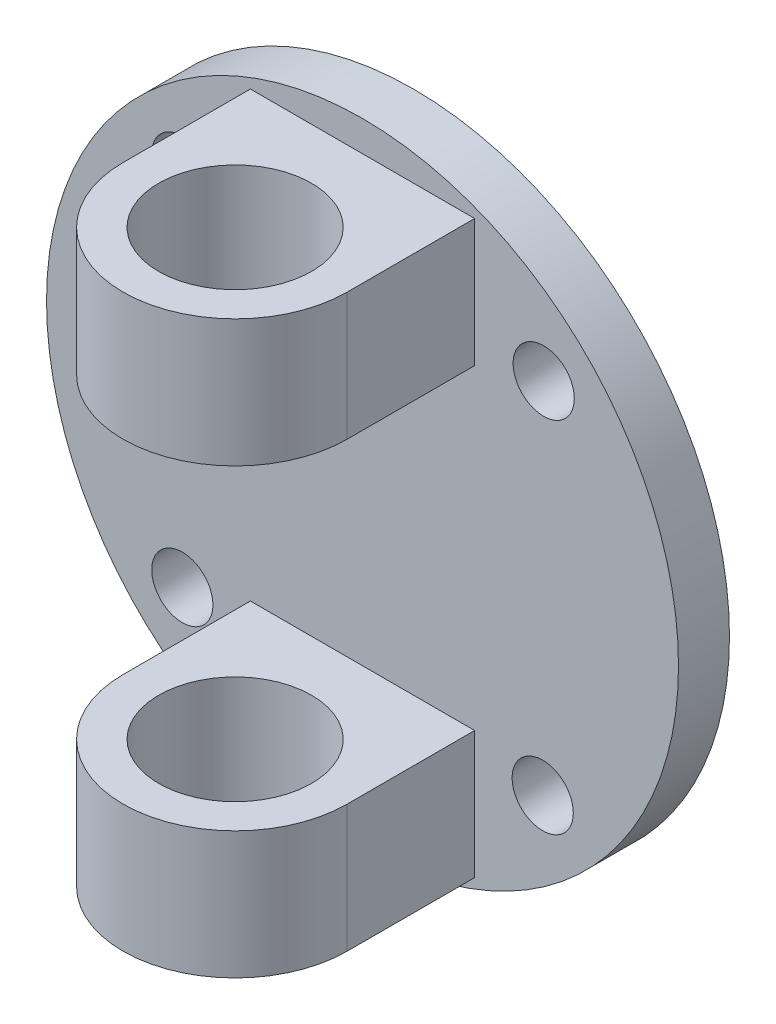
from build123d import *

# Parameters (mm, degrees)
SKETCH1_R           = 62
BOSS_EXTRUDE1_DEPTH = 10
SKETCH2_R           = 6
CUT_EXTRUDE1_DEPTH  = 10
SKETCH4_W           = 44
SKETCH4_H           = 25
BOSS_EXTRUDE2_DEPTH = 25
BOSS_EXTRUDE5_DEPTH = 25
BOSS_EXTRUDE6_START = -25
BOSS_EXTRUDE6_DEPTH = 25
SKETCH9_R           = 15
CUT_EXTRUDE2_DEPTH  = 25
CUT_EXTRUDE3_START  = -25
SKETCH10_R          = 15
CUT_EXTRUDE3_DEPTH  = 25


with BuildPart() as part:
    # Sketch1 → Boss-Extrude1 (new body)
    with BuildSketch(Plane.XY):
        Circle(SKETCH1_R)
    extrude(amount=BOSS_EXTRUDE1_DEPTH)

    # Sketch2 → Cut-Extrude1 (cut)
    with BuildSketch(Plane.XY.offset(10)):
        with Locations((35.355339059, -35.355339059)):
            Circle(SKETCH2_R)
        with Locations((-35.355339059, -35.355339059)):
            Circle(SKETCH2_R)
        with Locations((-35.355339059, 35.355339059)):
            Circle(SKETCH2_R)
        with Locations((35.548908594, 35.160703886)):
            Circle(SKETCH2_R)
    extrude(amount=-CUT_EXTRUDE1_DEPTH, mode=Mode.SUBTRACT)

    # Sketch4 → Boss-Extrude2 (add)
    with BuildSketch(Plane.XY.offset(10)):
        with Locations((0, 43.5)):
            Rectangle(SKETCH4_W, SKETCH4_H)
        with Locations((0, -43.5)):
            Rectangle(SKETCH4_W, SKETCH4_H)
    extrude(amount=BOSS_EXTRUDE2_DEPTH)

    # Sketch5 → Boss-Extrude5 (add)
    with BuildSketch(Plane(origin=(0, 56, 0), x_dir=(1, 0, 0), z_dir=(0, 1, 0))):
        with BuildLine():
            Line((-22, -35), (22, -35))
            ThreePointArc((22, -35), (0, -57), (-22, -35))
        make_face()
    extrude(amount=-BOSS_EXTRUDE5_DEPTH)

    # Sketch8 → Boss-Extrude6 (add)
    with BuildSketch(Plane.XZ.offset(56).offset(BOSS_EXTRUDE6_START)):
        with BuildLine():
            Line((-22, 35), (22, 35))
            ThreePointArc((22, 35), (0, 57), (-22, 35))
        make_face()
    extrude(amount=BOSS_EXTRUDE6_DEPTH)

    # Sketch9 → Cut-Extrude2 (cut)
    with BuildSketch(Plane(origin=(0, 56, 0), x_dir=(1, 0, 0), z_dir=(0, 1, 0))):
        with Locations(Location((0, -35, 0), (0, 0, 270))):
            Circle(SKETCH9_R)
    extrude(amount=-CUT_EXTRUDE2_DEPTH, mode=Mode.SUBTRACT)

    # Sketch10 → Cut-Extrude3 (cut)
    with BuildSketch(Plane.XZ.offset(56).offset(CUT_EXTRUDE3_START)):
        with Locations(Location((0, 35, 0), (0, 0, 90))):
            Circle(SKETCH10_R)
    extrude(amount=CUT_EXTRUDE3_DEPTH, mode=Mode.SUBTRACT)


solid = part.part
